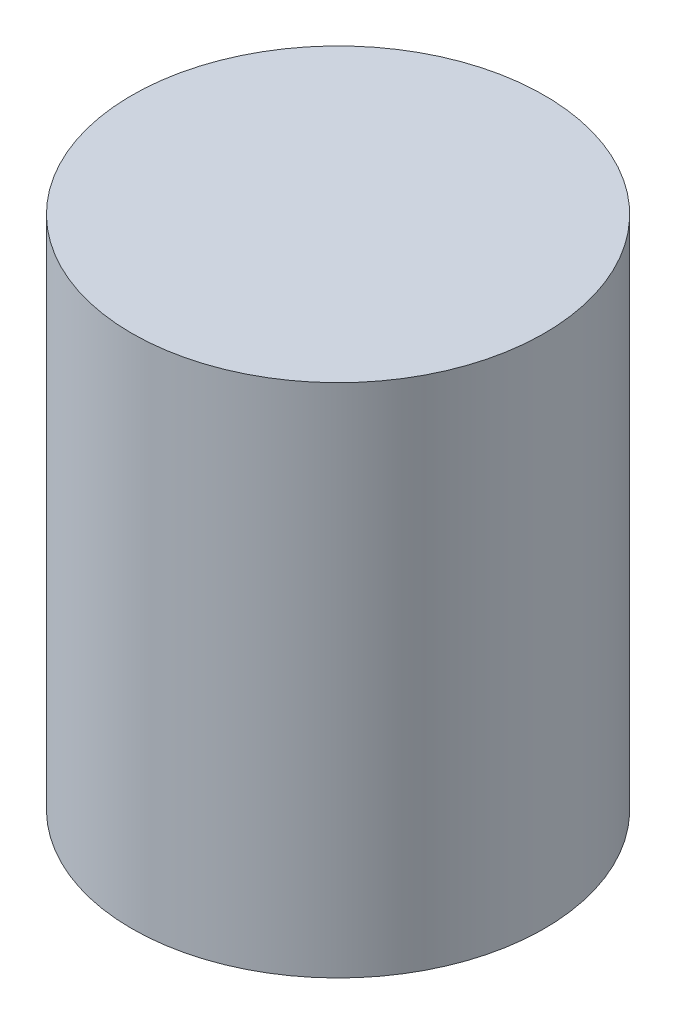
from build123d import *

# Parameters (mm, degrees)
SKETCH1_R           = 2.4
BOSS_EXTRUDE1_DEPTH = 6


with BuildPart() as part:
    # Sketch1 → Boss-Extrude1 (new body)
    with BuildSketch(Plane(origin=(0, 0, 0), x_dir=(1, 0, 0), z_dir=(0, 1, 0))):
        with Locations(Location((0, 0, 0), (0, 0, 270))):
            Circle(SKETCH1_R)
    extrude(amount=BOSS_EXTRUDE1_DEPTH)


solid = part.part
